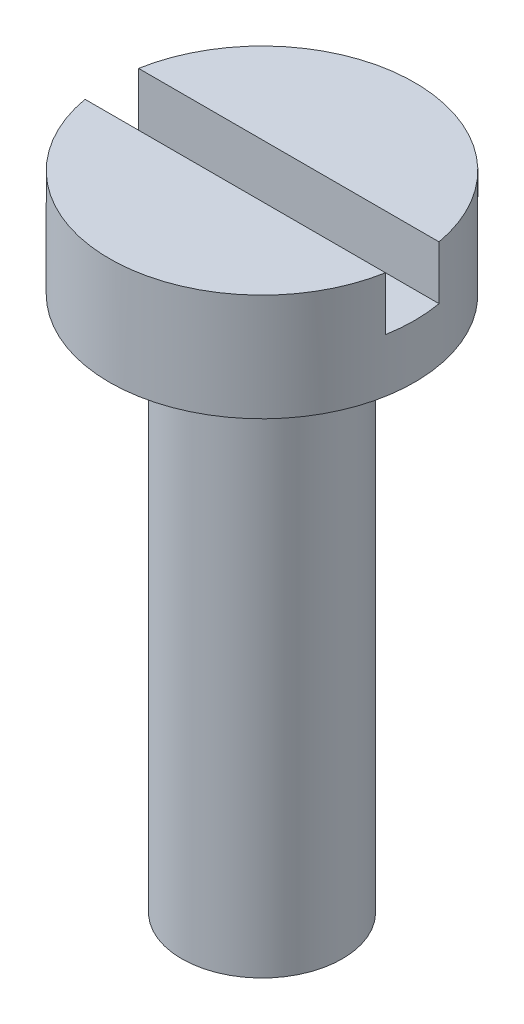
from build123d import *

# Parameters (mm, degrees)
SKETCH1_R           = 2.85
BOSS_EXTRUDE1_DEPTH = 2
SKETCH2_R           = 1.5
BOSS_EXTRUDE2_DEPTH = 10
SKETCH3_W           = 6
SKETCH3_H           = 1
CUT_EXTRUDE1_DEPTH  = 1


with BuildPart() as part:
    # Sketch1 → Boss-Extrude1 (new body)
    with BuildSketch(Plane(origin=(0, 0, 0), x_dir=(1, 0, 0), z_dir=(0, 1, 0))):
        with Locations(Location((0, 0, 0), (0, 0, 270))):
            Circle(SKETCH1_R)
    extrude(amount=BOSS_EXTRUDE1_DEPTH)

    # Sketch2 → Boss-Extrude2 (add)
    with BuildSketch(Plane(origin=(0, 0, 0), x_dir=(1, 0, 0), z_dir=(0, 1, 0))):
        with Locations(Location((0, 0, 0), (0, 0, 270))):
            Circle(SKETCH2_R)
    extrude(amount=-BOSS_EXTRUDE2_DEPTH)

    # Sketch3 → Cut-Extrude1 (cut)
    with BuildSketch(Plane(origin=(0, 2, 0), x_dir=(1, 0, 0), z_dir=(0, 1, 0))):
        Rectangle(SKETCH3_W, SKETCH3_H)
    extrude(amount=-CUT_EXTRUDE1_DEPTH, mode=Mode.SUBTRACT)


solid = part.part
